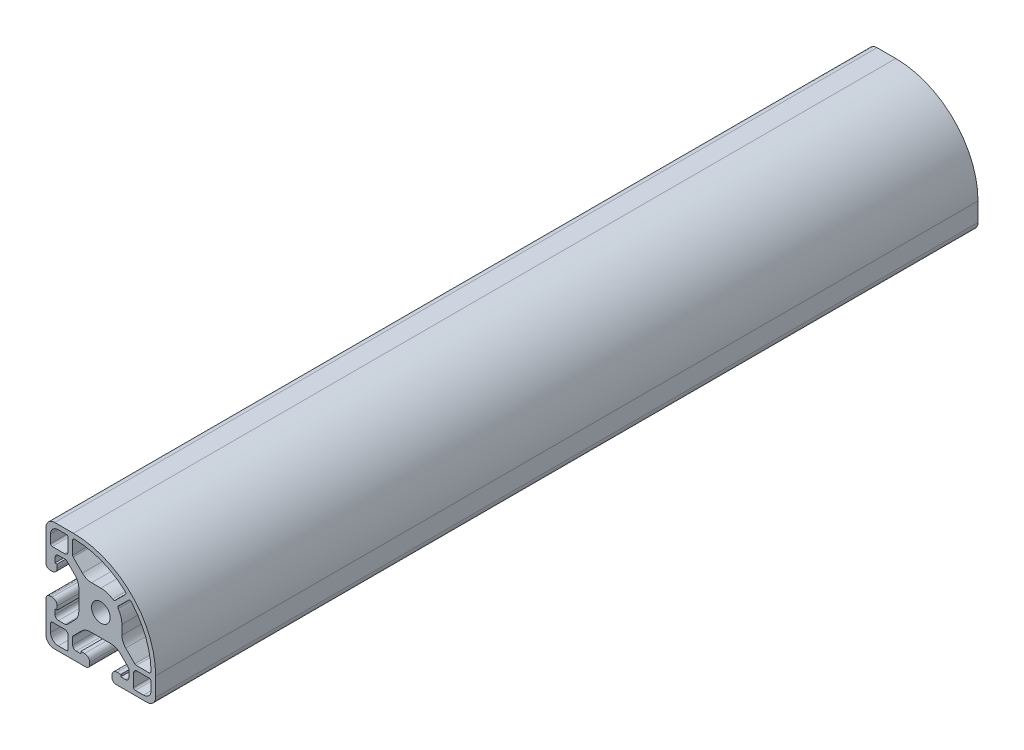
from build123d import *

# Parameters (mm, degrees)
SKETCH1_R      = 3.4
EXTRUDE1_DEPTH = 300


with BuildPart() as part:
    # Sketch1 → Extrude1 (new body)
    with BuildSketch(Plane.XY):
        with BuildLine():
            Line((-13.552721419, -20), (-17.142397126, -20))
            ThreePointArc((-17.142397126, -20), (-18.235954402, -19.782477933), (-19.163027496, -19.163027496))
            ThreePointArc((-19.163027496, -19.163027496), (-19.782477933, -18.235954402), (-20, -17.142397126))
            Line((-20, -17.142397126), (-20, -13.552721419))
            Line((-20, -13.552721419), (-20, -5.540330257))
            ThreePointArc((-20, -5.540330257), (-19.566421306, -4.493578694), (-18.519669743, -4.06))
            Line((-18.519669743, -4.06), (-17.804849126, -4.06))
            ThreePointArc((-17.804849126, -4.06), (-16.486201663, -4.606201663), (-15.94, -5.924849126))
            Line((-15.94, -5.924849126), (-15.94, -7.280726922))
            Line((-15.94, -7.280726922), (-16.7, -7.280726922))
            Line((-16.7, -7.280726922), (-16.7, -9.015))
            ThreePointArc((-16.7, -9.015), (-16.328025612, -9.913025612), (-15.43, -10.285))
            Line((-15.43, -10.285), (-13.053775012, -10.285))
            ThreePointArc((-13.053775012, -10.285), (-12.65158934, -10.205000296), (-12.310632791, -9.977180413))
            Line((-12.310632791, -9.977180413), (-9.431242789, -7.097790411))
            ThreePointArc((-9.431242789, -7.097790411), (-8.401572221, -5.556779505), (-8.04, -3.739033201))
            Line((-8.04, -3.739033201), (-8.04, 3.739033201))
            ThreePointArc((-8.04, 3.739033201), (-8.401572221, 5.556779505), (-9.431242789, 7.097790411))
            Line((-9.431242789, 7.097790411), (-12.357777413, 10.024325035))
            ThreePointArc((-12.357777413, 10.024325035), (-12.646514194, 10.217252784), (-12.987102448, 10.285))
            Line((-12.987102448, 10.285), (-15.363327437, 10.285))
            ThreePointArc((-15.363327437, 10.285), (-16.30849767, 9.89349767), (-16.7, 8.948327437))
            Line((-16.7, 8.948327437), (-16.7, 7.280726922))
            Line((-16.7, 7.280726922), (-15.94, 7.280726922))
            Line((-15.94, 7.280726922), (-15.94, 5.924849126))
            ThreePointArc((-15.94, 5.924849126), (-16.486201663, 4.606201663), (-17.804849126, 4.06))
            Line((-17.804849126, 4.06), (-18.519669743, 4.06))
            ThreePointArc((-18.519669743, 4.06), (-19.566421306, 4.493578694), (-20, 5.540330257))
            Line((-20, 5.540330257), (-20, 12.563650804))
            Line((-20, 12.563650804), (-20, 16.832984559))
            ThreePointArc((-20, 16.832984559), (-19.072402654, 19.072402654), (-16.832984559, 20))
            Line((-16.832984559, 20), (-10, 20))
            ThreePointArc((-10, 20), (11.213203436, 11.213203436), (20, -10))
            Line((20, -10), (20, -16.832984559))
            ThreePointArc((20, -16.832984559), (19.072402654, -19.072402654), (16.832984559, -20))
            Line((16.832984559, -20), (12.563650804, -20))
            Line((12.563650804, -20), (5.540330257, -20))
            ThreePointArc((5.540330257, -20), (4.493578694, -19.566421306), (4.06, -18.519669743))
            Line((4.06, -18.519669743), (4.06, -17.804849126))
            ThreePointArc((4.06, -17.804849126), (4.606201663, -16.486201663), (5.924849126, -15.94))
            Line((5.924849126, -15.94), (7.280726922, -15.94))
            Line((7.280726922, -15.94), (7.280726922, -16.7))
            Line((7.280726922, -16.7), (8.948327437, -16.7))
            ThreePointArc((8.948327437, -16.7), (9.89349767, -16.30849767), (10.285, -15.363327437))
            Line((10.285, -15.363327437), (10.285, -12.987102448))
            ThreePointArc((10.285, -12.987102448), (10.217252784, -12.646514194), (10.024325035, -12.357777413))
            Line((10.024325035, -12.357777413), (7.097790411, -9.431242789))
            ThreePointArc((7.097790411, -9.431242789), (5.556779505, -8.401572221), (3.739033201, -8.04))
            Line((3.739033201, -8.04), (-3.739033201, -8.04))
            ThreePointArc((-3.739033201, -8.04), (-5.556779505, -8.401572221), (-7.097790411, -9.431242789))
            Line((-7.097790411, -9.431242789), (-9.977180413, -12.310632791))
            ThreePointArc((-9.977180413, -12.310632791), (-10.205000296, -12.65158934), (-10.285, -13.053775012))
            Line((-10.285, -13.053775012), (-10.285, -15.43))
            ThreePointArc((-10.285, -15.43), (-9.913025612, -16.328025612), (-9.015, -16.7))
            Line((-9.015, -16.7), (-7.280726922, -16.7))
            Line((-7.280726922, -16.7), (-7.280726922, -15.94))
            Line((-7.280726922, -15.94), (-5.924849126, -15.94))
            ThreePointArc((-5.924849126, -15.94), (-4.606201663, -16.486201663), (-4.06, -17.804849126))
            Line((-4.06, -17.804849126), (-4.06, -18.519669743))
            ThreePointArc((-4.06, -18.519669743), (-4.493578694, -19.566421306), (-5.540330257, -20))
            Line((-5.540330257, -20), (-13.552721419, -20))
        make_face()
        Circle(SKETCH1_R, mode=Mode.SUBTRACT)
        with BuildLine():
            Line((-11.925, -17.705), (-11.925, -13.195))
            ThreePointArc((-11.925, -13.195), (-12.296974388, -12.296974388), (-13.195, -11.925))
            Line((-13.195, -11.925), (-17.705, -11.925))
            ThreePointArc((-17.705, -11.925), (-18.150477272, -12.109522728), (-18.335, -12.555))
            Line((-18.335, -12.555), (-18.335, -15.535))
            ThreePointArc((-18.335, -15.535), (-17.514898987, -17.514898987), (-15.535, -18.335))
            Line((-15.535, -18.335), (-12.555, -18.335))
            ThreePointArc((-12.555, -18.335), (-12.109522728, -18.150477272), (-11.925, -17.705))
        make_face(mode=Mode.SUBTRACT)
        with BuildLine():
            Line((7.679270597, 0), (7.679270597, -3.378303798))
            ThreePointArc((7.679270597, -3.378303798), (8.040842817, -5.196050101), (9.070513386, -6.737061008))
            Line((9.070513386, -6.737061008), (12.400776329, -10.067323951))
            ThreePointArc((12.400776329, -10.067323951), (12.647338074, -10.232071242), (12.938177482, -10.289922797))
            Line((12.938177482, -10.289922797), (17.586072346, -10.289922797))
            ThreePointArc((17.586072346, -10.289922797), (18.12803226, -10.062726187), (18.345962028, -9.516973987))
            ThreePointArc((18.345962028, -9.516973987), (16.406061612, 0.317305248), (11.165061741, 8.861787798))
            ThreePointArc((11.165061741, 8.861787798), (10.619514718, 9.11583304), (10.060274233, 8.893548045))
            Line((10.060274233, 8.893548045), (6.444636983, 5.277910795))
            ThreePointArc((6.444636983, 5.277910795), (6.225426758, 4.812198006), (6.353269463, 4.313602211))
            ThreePointArc((6.353269463, 4.313602211), (7.34028856, 2.256404387), (7.679270597, 0))
        make_face(mode=Mode.SUBTRACT)
        with BuildLine():
            Line((17.720077203, -11.939922797), (13.210077203, -11.939922797))
            ThreePointArc((13.210077203, -11.939922797), (12.312051591, -12.311897185), (11.940077203, -13.209922797))
            Line((11.940077203, -13.209922797), (11.940077203, -17.719922797))
            ThreePointArc((11.940077203, -17.719922797), (12.124599931, -18.165400069), (12.570077203, -18.349922797))
            Line((12.570077203, -18.349922797), (15.550077203, -18.349922797))
            ThreePointArc((15.550077203, -18.349922797), (17.52997619, -17.529821784), (18.350077203, -15.549922797))
            Line((18.350077203, -15.549922797), (18.350077203, -12.569922797))
            ThreePointArc((18.350077203, -12.569922797), (18.165554475, -12.124445525), (17.720077203, -11.939922797))
        make_face(mode=Mode.SUBTRACT)
        with BuildLine():
            Line((-13.209922797, 11.940077203), (-17.719922797, 11.940077203))
            ThreePointArc((-17.719922797, 11.940077203), (-18.165400069, 12.124599931), (-18.349922797, 12.570077203))
            Line((-18.349922797, 12.570077203), (-18.349922797, 15.550077203))
            ThreePointArc((-18.349922797, 15.550077203), (-17.529821784, 17.52997619), (-15.549922797, 18.350077203))
            Line((-15.549922797, 18.350077203), (-12.569922797, 18.350077203))
            ThreePointArc((-12.569922797, 18.350077203), (-12.124445525, 18.165554475), (-11.939922797, 17.720077203))
            Line((-11.939922797, 17.720077203), (-11.939922797, 13.210077203))
            ThreePointArc((-11.939922797, 13.210077203), (-12.311897185, 12.312051591), (-13.209922797, 11.940077203))
        make_face(mode=Mode.SUBTRACT)
        with BuildLine():
            Line((8.893548045, 10.060274233), (5.277910795, 6.444636983))
            ThreePointArc((5.277910795, 6.444636983), (4.812198006, 6.225426758), (4.313602211, 6.353269463))
            ThreePointArc((4.313602211, 6.353269463), (2.256404387, 7.34028856), (0, 7.679270597))
            Line((0, 7.679270597), (-3.378303798, 7.679270597))
            ThreePointArc((-3.378303798, 7.679270597), (-5.196050101, 8.040842817), (-6.737061008, 9.070513386))
            Line((-6.737061008, 9.070513386), (-10.067323951, 12.400776329))
            ThreePointArc((-10.067323951, 12.400776329), (-10.232071242, 12.647338074), (-10.289922797, 12.938177482))
            Line((-10.289922797, 12.938177482), (-10.289922797, 17.586072346))
            ThreePointArc((-10.289922797, 17.586072346), (-10.062726187, 18.12803226), (-9.516973987, 18.345962028))
            ThreePointArc((-9.516973987, 18.345962028), (0.317305248, 16.406061612), (8.861787798, 11.165061741))
            ThreePointArc((8.861787798, 11.165061741), (9.11583304, 10.619514718), (8.893548045, 10.060274233))
        make_face(mode=Mode.SUBTRACT)
    extrude(amount=-EXTRUDE1_DEPTH)


solid = part.part
